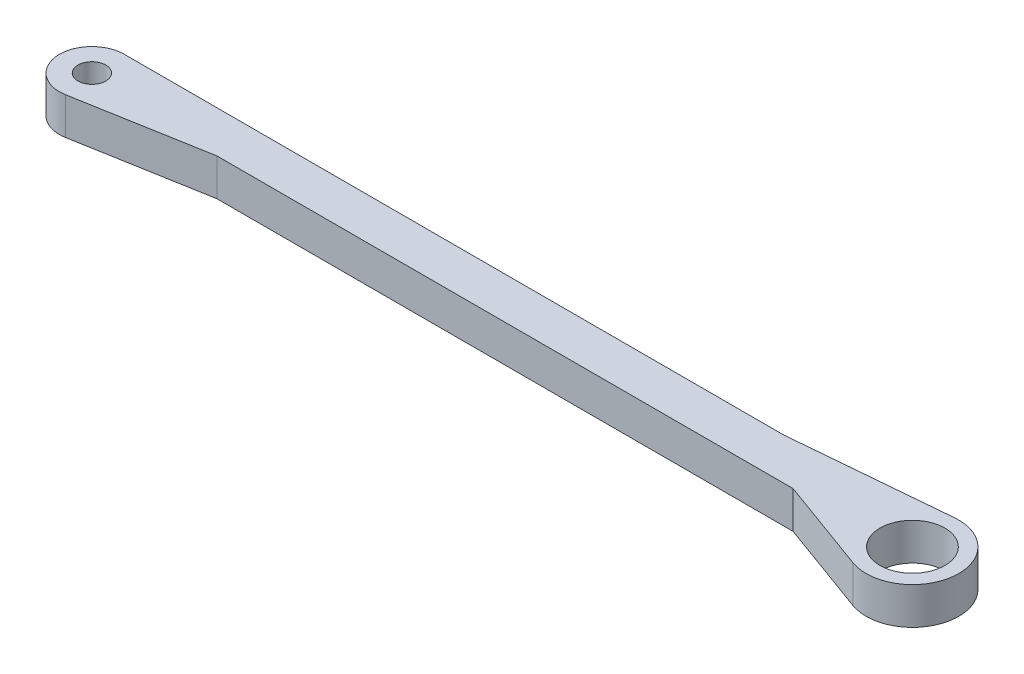
from build123d import *

# Parameters (mm, degrees)
SKETCH_1_R      = 3
SKETCH_1_R_2    = 7
EXTRUDE_2_DEPTH = 8


with BuildPart() as part:
    # 草图1 → 凸台-拉伸2 (new body)
    with BuildSketch(Plane(origin=(0, 0, 0), x_dir=(1, 0, 0), z_dir=(0, 1, 0))):
        with BuildLine():
            ThreePointArc((0, 7), (-6.973362887, -0.610090199), (1.215537244, -6.893654271))
            Line((1.215537244, -6.893654271), (28.968829743, -2))
            Line((28.968829743, -2), (153.256910837, -2))
            Line((153.256910837, -2), (173.579798567, -9.396926208))
            ThreePointArc((173.579798567, -9.396926208), (186.914448614, -1.305261922), (176.128442573, 9.961946981))
            Line((176.128442573, 9.961946981), (142.273233663, 7))
            Line((142.273233663, 7), (0, 7))
        make_face()
        with Locations(Location((0, 0, 0), (0, 0, 270))):
            Circle(SKETCH_1_R, mode=Mode.SUBTRACT)
        with Locations(Location((177, 0, 0), (0, 0, 270))):
            Circle(SKETCH_1_R_2, mode=Mode.SUBTRACT)
    extrude(amount=EXTRUDE_2_DEPTH)


solid = part.part
